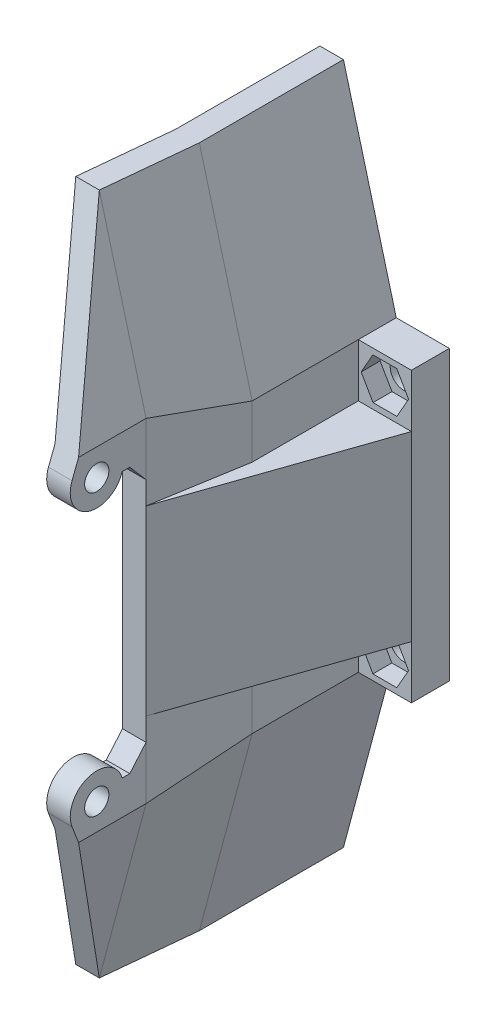
from build123d import *

# Parameters (mm, degrees)
BOSS_EXTRU_1_DEPTH      = 5
BOSS_EXTRU_2_DEPTH      = 14
ESQUISSE5_R             = 1.8
ENL_V_MAT_EXTRU_1_DEPTH = 56.088510189
BOSS_EXTRU_3_DEPTH      = 15
ESQUISSE7_R             = 1.6
ENL_V_MAT_EXTRU_2_DEPTH = 66.014675864
ESQUISSE3_4_OUTSIDE_W   = 40.383
ESQUISSE3_4_OUTSIDE_H   = 112.114
ENL_V_MAT_EXTRU_5_DEPTH = 58.617219265
NERVURE2_REACH          = 65.559
ESQUISSE9_WALL_W        = 156.631593158
ESQUISSE9_WALL_H        = 24
ENL_V_MAT_EXTRU_6_DEPTH = 2.5


with BuildPart() as part:
    # Esquisse1 → Boss.-Extru.1 (new body)
    with BuildSketch(Plane.XY):
        Polygon((-10.105828541, -19), (-10.105828541, 19), (-17.072507544, 45), (-13.966679003, 45), (-7, 19), (0, 19), (0, -19), (-7, -19), (-13.966679003, -45), (-17.072507544, -45), align=None)
    extrude(amount=BOSS_EXTRU_1_DEPTH)

    # Esquisse2 → Boss.-Extru.2 (add)
    with BuildSketch(Plane.XY.offset(5)):
        Polygon((-17.072507544, 45), (-10.105828541, 19), (-10.105828541, -19), (-17.072507544, -45), (-13.966679003, -45), (-7, -19), (-7, 19), (-13.966679003, 45), align=None)
    extrude(amount=BOSS_EXTRU_2_DEPTH)

    # Esquisse4 → Lissage1 section 0
    with BuildSketch(Plane.XY.offset(19)):
        with BuildLine():
            Line((-13.966679003, -45), (-7, -19))
            Line((-7, -19), (-7, 19))
            Line((-7, 19), (-13.966679003, 45))
            Line((-13.966679003, 45), (-17.072507544, 45))
            Line((-17.072507544, 45), (-10.105828541, 19))
            Line((-10.105828541, 19), (-10.105828541, -19))
            Line((-10.105828541, -19), (-17.072507544, -45))
            Line((-17.072507544, -45), (-13.966679003, -45))
        make_face()
    # Esquisse3 → Lissage1 section 1
    with BuildSketch(Plane.XY.offset(31)):
        with BuildLine():
            Line((-18.268659967, 45), (-15.162831426, 45))
            Line((-15.162831426, 45), (-9, 22))
            Line((-9, 22), (-9, -22))
            Line((-9, -22), (-15.162831426, -45))
            Line((-15.162831426, -45), (-18.268659967, -45))
            Line((-18.268659967, -45), (-12.105828541, -22))
            Line((-12.105828541, -22), (-12.105828541, 22))
            Line((-12.105828541, 22), (-18.268659967, 45))
        make_face()
    loft()

    # Esquisse5 → Enlèv. mat.-Extru.1 (cut, through all)
    with BuildSketch(Plane.XY.offset(5)):
        with Locations(Location((-3.5, -15.5, 0), (0, 0, 180))):
            Circle(ESQUISSE5_R)
        with Locations((-3.5, 15.5)):
            Circle(ESQUISSE5_R)
    extrude(amount=-ENL_V_MAT_EXTRU_1_DEPTH, mode=Mode.SUBTRACT)

    # Esquisse6 → Boss.-Extru.3 (add)
    with BuildSketch(Plane.XY.offset(31)):
        Polygon((-9, 45), (-18.268659967, 45), (-12.105828541, 22), (-12.105828541, -22), (-18.268659967, -45), (-9, -45), align=None)
    extrude(amount=BOSS_EXTRU_3_DEPTH)

    # Esquisse7 → Enlèv. mat.-Extru.2 (cut, through all)
    with BuildSketch(Plane.ZY.offset(9)):
        with BuildLine():
            ThreePointArc((40.764205464, 19.762918321), (38.632351614, 15.188236146), (34.145898034, 17.5))
            Line((34.145898034, 17.5), (33.145898034, 17.5))
            Line((33.145898034, 17.5), (31, 15))
            Line((31, 15), (31, -15))
            Line((31, -15), (33.145898034, -17.5))
            Line((33.145898034, -17.5), (34.145898034, -17.5))
            ThreePointArc((34.145898034, -17.5), (38.632351614, -15.188236146), (40.764205464, -19.762918321))
            Line((40.764205464, -19.762918321), (31, -45))
            Line((31, -45), (46, -45))
            Line((46, -45), (46, 45))
            Line((46, 45), (31, 45))
            Line((31, 45), (40.764205464, 19.762918321))
        make_face()
        with Locations(Location((37.5, 18.5, 0), (0, 0, 180))):
            Circle(ESQUISSE7_R)
        with Locations(Location((37.5, -18.5, 0), (0, 0, 90))):
            Circle(ESQUISSE7_R)
    extrude(amount=ENL_V_MAT_EXTRU_2_DEPTH, mode=Mode.SUBTRACT)

    # Esquisse3<4> outside → Enlèv. mat.-Extru.5 (cut, through all)
    with BuildSketch(Plane.XY.offset(31)):
        with Locations((-9.1345, 0)):
            Rectangle(ESQUISSE3_4_OUTSIDE_W, ESQUISSE3_4_OUTSIDE_H)
        Polygon((-18.268659967, 45), (-15.162831426, 45), (-9, 22), (-9, -22), (-15.162831426, -45), (-18.268659967, -45), (-12.105828541, -22), (-12.105828541, 22), align=None, mode=Mode.SUBTRACT)
    extrude(amount=ENL_V_MAT_EXTRU_5_DEPTH, mode=Mode.SUBTRACT)

    # Esquisse9 wall → Nervure2 (add, up to next)
    with BuildSketch(Plane(origin=(-4.5, 0, 18), x_dir=(-0.327110563883, 0, 0.94498607344), z_dir=(-0.94498607344, 0, -0.327110563883)), mode=Mode.PRIVATE) as nervure2_sk1:
        Rectangle(ESQUISSE9_WALL_W, ESQUISSE9_WALL_H)
    nervure2_tool1 = extrude(nervure2_sk1.sketch, amount=NERVURE2_REACH, mode=Mode.PRIVATE) - part.part
    add(nervure2_tool1.solids().sort_by_distance((-4.5, 0, 18))[0])

    # Esquisse10 → Enlèv. mat.-Extru.6 (cut)
    with BuildSketch(Plane.XY.offset(5)):
        Polygon((-5.079865302, 18.225165248), (-1.939526432, 18.225165248), (-0.369356996, 15.50555201), (-1.920134698, 12.774834752), (-5.060473568, 12.774834752), (-6.630643004, 15.49444799), align=None)
        Polygon((-6.630643004, -15.49444799), (-5.079865302, -18.225165248), (-1.939526432, -18.225165248), (-0.369356996, -15.50555201), (-1.920134698, -12.774834752), (-5.060473568, -12.774834752), align=None)
    extrude(amount=-ENL_V_MAT_EXTRU_6_DEPTH, mode=Mode.SUBTRACT)


solid = part.part
